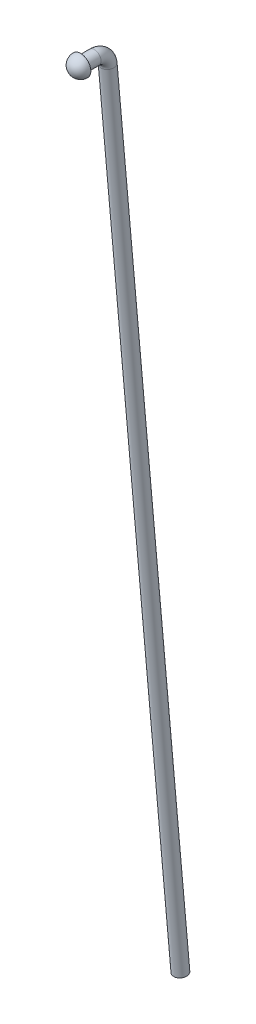
from build123d import *

# Parameters (mm, degrees)
SKETCH3_R = 1.5


with BuildPart() as part:
    # Sweep1: sweep along a path in Sketch2
    with BuildLine(Plane(origin=(0, 0, 0), x_dir=(0, 0, -1), z_dir=(1, 0, 0))) as sweep1_path:
        Line((0, 39.367313199), (3.093413629, 39.367313199))
        ThreePointArc((3.093413629, 39.367313199), (5.119218965, 38.580029344), (6.081768412, 36.631388359))
        Line((6.081768412, 36.631388359), (22.423920046, -148.301367182))
    # Sketch3 → Sweep1 (sweep)
    with BuildSketch(Plane.XY):
        with Locations((0, 39.367313199)):
            Circle(SKETCH3_R)
    sweep(path=sweep1_path.line)

    # Sketch4 → Revolve1 (revolve)
    with BuildSketch(Plane(origin=(0, 0, 0), x_dir=(0, 0, -1), z_dir=(1, 0, 0))):
        with BuildLine():
            Line((0, 39.367313199), (0, 41.667313199))
            ThreePointArc((0, 41.667313199), (-1.626345597, 40.993658795), (-2.3, 39.367313199))
            Line((-2.3, 39.367313199), (0, 39.367313199))
        make_face()
    revolve(axis=Axis((0, 39.367313199, 2.3), (0, 0, -1)))


solid = part.part
